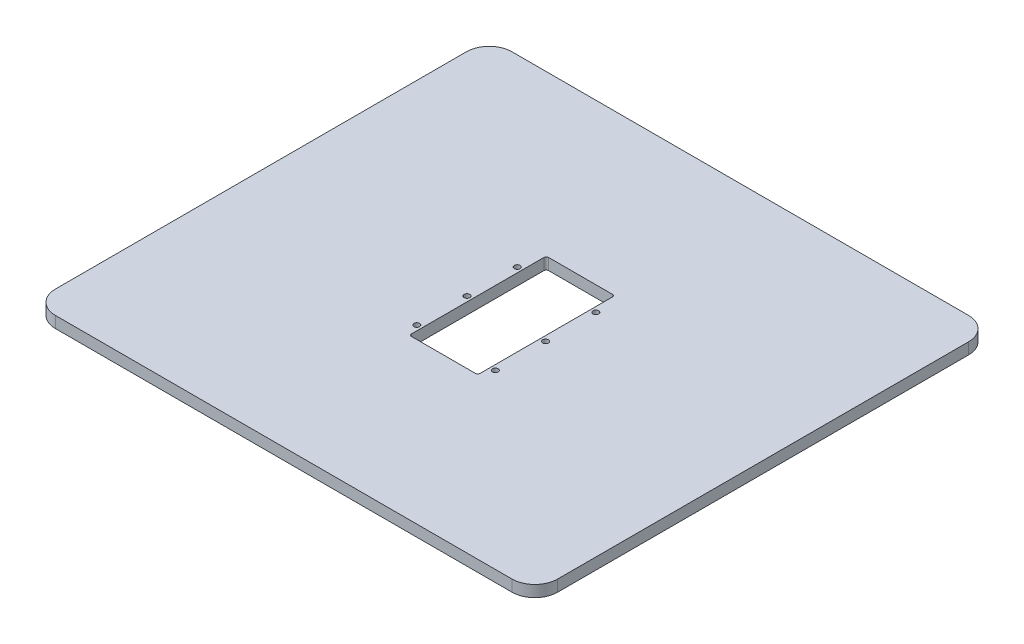
from build123d import *

# Parameters (mm, degrees)
ESBO_O1_R                = 1.25
RESSALTO_EXTRUS_O1_DEPTH = 5


with BuildPart() as part:
    # Esboço1 → Ressalto-extrusão1 (new body)
    with BuildSketch(Plane(origin=(0, 0, 0), x_dir=(1, 0, 0), z_dir=(0, 1, 0))):
        with BuildLine():
            Line((100, -100), (-100, -100))
            ThreePointArc((-100, -100), (-107.071067812, -97.071067812), (-110, -90))
            Line((-110, -90), (-110, 90))
            ThreePointArc((-110, 90), (-107.071067812, 97.071067812), (-100, 100))
            Line((-100, 100), (100, 100))
            ThreePointArc((100, 100), (107.071067812, 97.071067812), (110, 90))
            Line((110, 90), (110, -90))
            ThreePointArc((110, -90), (107.071067812, -97.071067812), (100, -100))
        make_face()
        with Locations(Location((17.2, 19.5, 0), (0, 0, 270))):
            Circle(ESBO_O1_R, mode=Mode.SUBTRACT)
        with Locations(Location((17.2, -2.5, 0), (0, 0, 270))):
            Circle(ESBO_O1_R, mode=Mode.SUBTRACT)
        with Locations(Location((17.2, -24.5, 0), (0, 0, 270))):
            Circle(ESBO_O1_R, mode=Mode.SUBTRACT)
        with Locations(Location((-17.2, -24.5, 0), (0, 0, 90))):
            Circle(ESBO_O1_R, mode=Mode.SUBTRACT)
        with Locations(Location((-17.2, -2.5, 0), (0, 0, 90))):
            Circle(ESBO_O1_R, mode=Mode.SUBTRACT)
        with Locations(Location((-17.2, 19.5, 0), (0, 0, 90))):
            Circle(ESBO_O1_R, mode=Mode.SUBTRACT)
        with BuildLine():
            Line((14, 30), (-14, 30))
            ThreePointArc((-14, 30), (-14.707106781, 29.707106781), (-15, 29))
            Line((-15, 29), (-15, -29))
            ThreePointArc((-15, -29), (-14.707106781, -29.707106781), (-14, -30))
            Line((-14, -30), (14, -30))
            ThreePointArc((14, -30), (14.707106781, -29.707106781), (15, -29))
            Line((15, -29), (15, 29))
            ThreePointArc((15, 29), (14.707106781, 29.707106781), (14, 30))
        make_face(mode=Mode.SUBTRACT)
    extrude(amount=RESSALTO_EXTRUS_O1_DEPTH)


solid = part.part
